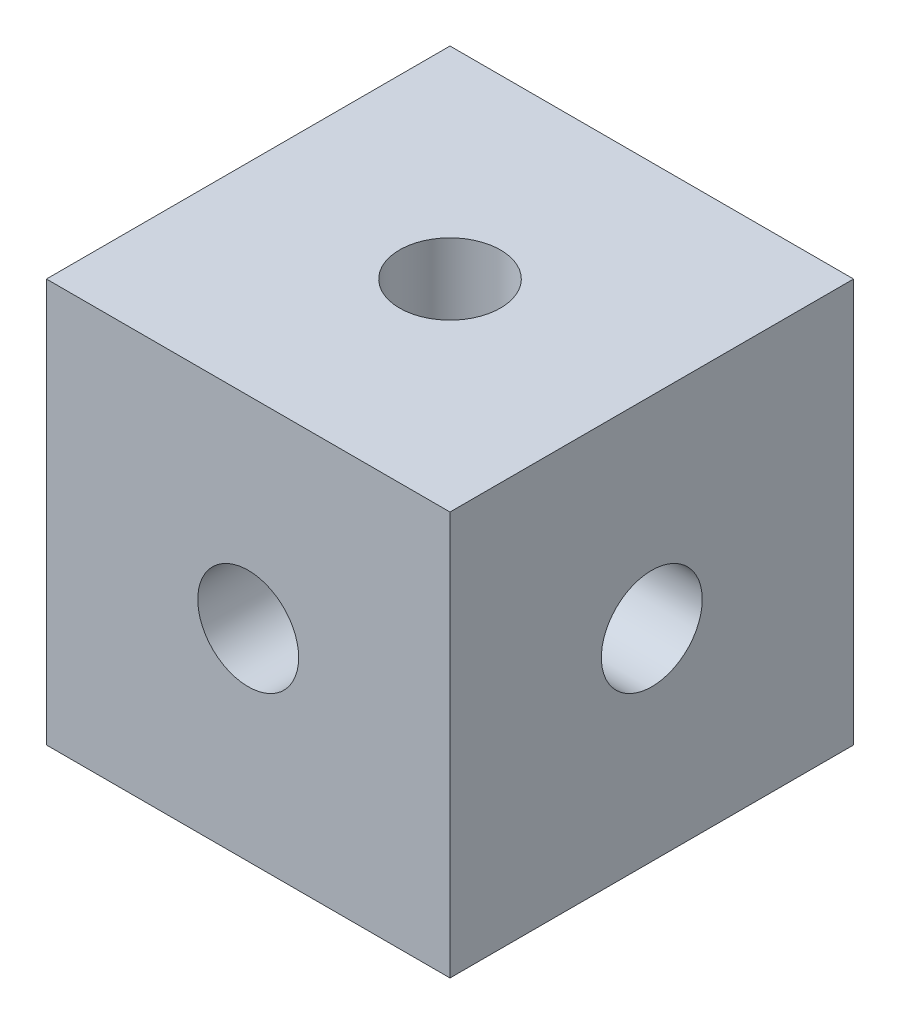
from build123d import *

# Parameters (mm, degrees)
SKETCH_1_W         = 10
SKETCH_1_H         = 10
EXTRUDE_1_DEPTH    = 5
HOLE_WIZARD_M3_1_D = 2.5
HOLE_WIZARD_M3_2_D = 2.5
HOLE_WIZARD_M3_3_D = 2.5


with BuildPart() as part:
    # 草图1 → 凸台-拉伸1 (new, symmetric)
    with BuildSketch(Plane(origin=(0, 0, 0), x_dir=(1, 0, 0), z_dir=(0, 1, 0))):
        Rectangle(SKETCH_1_W, SKETCH_1_H)
    extrude(amount=EXTRUDE_1_DEPTH, both=True)

    # M3 螺纹孔1 (through all)
    with Locations(Plane.XY.offset(5)):
        with Locations((0, 0)):
            Hole(HOLE_WIZARD_M3_1_D / 2)

    # M3 螺纹孔2 (through all)
    with Locations(Plane(origin=(5, 0, 0), x_dir=(0, 0, -1), z_dir=(1, 0, 0))):
        with Locations((0, 0)):
            Hole(HOLE_WIZARD_M3_2_D / 2)

    # M3 螺纹孔3 (through all)
    with Locations(Plane(origin=(0, 5, 0), x_dir=(1, 0, 0), z_dir=(0, 1, 0))):
        with Locations((0, 0)):
            Hole(HOLE_WIZARD_M3_3_D / 2)


solid = part.part
